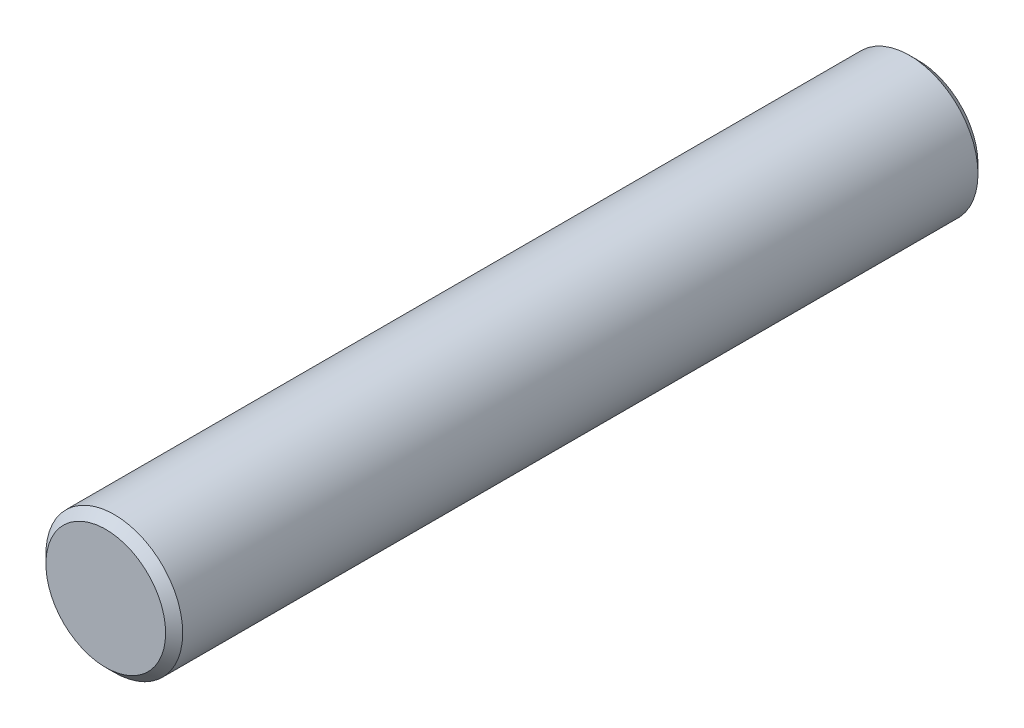
from build123d import *

# Parameters (mm, degrees)
SKETCH1_R           = 4
BOSS_EXTRUDE1_DEPTH = 47.5
CHAMFER1_SIZE       = 0.5


with BuildPart() as part:
    # Sketch1 → Boss-Extrude1 (new body)
    with BuildSketch(Plane.XY):
        Circle(SKETCH1_R)
    extrude(amount=BOSS_EXTRUDE1_DEPTH)

    # Chamfer1
    chamfer1_edges = [part.edges().sort_by_distance(p)[0] for p in [
        (-4, 0, 0),
        (-4, 0, 47.5),
    ]]
    chamfer(chamfer1_edges, length=CHAMFER1_SIZE)


solid = part.part
